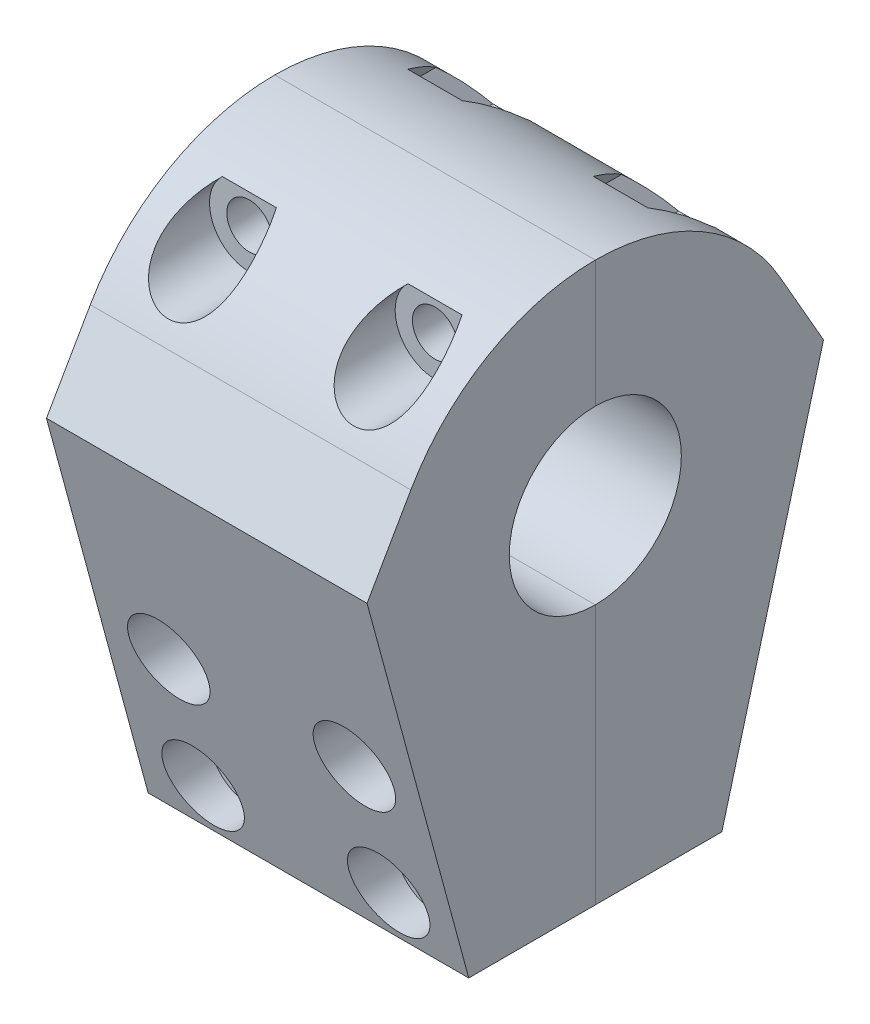
from build123d import *

# Parameters (mm, degrees)
SKETCH1_W              = 24.13
SKETCH1_H              = 19.05
SKETCH1_RX             = 3.81
SKETCH1_RY             = 3.175
BOSS_EXTRUDE1_DEPTH    = 8.255
SKETCH18_R             = 6.477
BOSS_EXTRUDE6_DEPTH    = 24.13
SKETCH4_R              = 1.7
CUT_EXTRUDE1_DEPTH     = 45.719846392
CUT_EXTRUDE4_START     = -2.54
SKETCH13_R             = 2.999999969
CUT_EXTRUDE4_DEPTH     = 48.259846392
CUT_EXTRUDE6_START     = -2.54
CUT_EXTRUDE6_DEPTH     = 48.259846392
SPLIT1_SURFACE_1_BACK  = 60.412
SPLIT1_SURFACE_1_DEPTH = 120.824
SPLIT1_SURFACE_2_BACK  = 60.412
SPLIT1_SURFACE_2_DEPTH = 120.824


with BuildPart() as part:
    # Sketch1 → Boss-Extrude1 (new, symmetric)
    with BuildSketch(Plane(origin=(0, 0, 0), x_dir=(1, 0, 0), z_dir=(0, 1, 0))):
        Rectangle(SKETCH1_W, SKETCH1_H)
        with Locations(Location((0, 0), (0, 0, 180))):
            Ellipse(SKETCH1_RX, SKETCH1_RY, mode=Mode.SUBTRACT)
    extrude(amount=BOSS_EXTRUDE1_DEPTH, both=True)

    # Sketch18 → Boss-Extrude6 (add)
    with BuildSketch(Plane.ZY.offset(12.065)):
        with BuildLine():
            Line((15.445133453, 13.595282971), (9.525, -8.255))
            Line((9.525, -8.255), (9.525, 8.255))
            Line((9.525, 8.255), (-9.525, 8.255))
            Line((-9.525, 8.255), (-9.525, -8.255))
            Line((-9.525, -8.255), (-15.445133453, 13.595282971))
            Line((-15.445133453, 13.595282971), (-17.178500001, 19.99286672))
            Line((-17.178500001, 19.99286672), (-13.88040039, 25.742316812))
            ThreePointArc((-13.88040039, 25.742316812), (0, 33.782), (13.88040039, 25.742316812))
            Line((13.88040039, 25.742316812), (17.178500001, 19.99286672))
            Line((17.178500001, 19.99286672), (15.445133453, 13.595282971))
        make_face()
        with Locations((0, 17.78)):
            Circle(SKETCH18_R, mode=Mode.SUBTRACT)
    extrude(amount=-BOSS_EXTRUDE6_DEPTH)

    # Sketch4 → Cut-Extrude1 (cut, through all)
    with BuildSketch(Plane.XY.offset(9.525)):
        with Locations((-6.985, 4.7625)):
            Circle(SKETCH4_R)
    cut_extrude1 = extrude(amount=-CUT_EXTRUDE1_DEPTH, mode=Mode.SUBTRACT)

    # Sketch13 → Cut-Extrude4 (cut)
    with BuildSketch(Plane.XY.offset(9.525).offset(CUT_EXTRUDE4_START)):
        with Locations(Location((-6.985, 4.7625, 0), (0, 0, 270))):
            Circle(SKETCH13_R)
    cut_extrude4 = extrude(amount=CUT_EXTRUDE4_DEPTH, mode=Mode.SUBTRACT)

    # Sketch19 → Cut-Extrude6 (cut)
    with BuildSketch(Plane(origin=(0, 0, -9.525), x_dir=(-1, 0, 0), z_dir=(0, 0, -1)).offset(CUT_EXTRUDE6_START)):
        Polygon((10.304764007, 4.7625), (8.644882004, 7.637499965), (5.325117996, 7.637499965), (3.665235993, 4.7625), (5.325117996, 1.887500035), (8.644882004, 1.887500035), align=None)
    cut_extrude6 = extrude(amount=CUT_EXTRUDE6_DEPTH, mode=Mode.SUBTRACT)

    # Sketch-Pattern1: Cut-Extrude1, Cut-Extrude4, Cut-Extrude6 at 5 more places
    with Locations((0, -9.525, 0), (13.97, 0, 0), (13.97, -9.525, 0), (13.97, 25.2095, 0), (0, 25.2095, 0)):
        add(cut_extrude1, mode=Mode.SUBTRACT)
        add(cut_extrude4, mode=Mode.SUBTRACT)
        add(cut_extrude6, mode=Mode.SUBTRACT)


with BuildPart() as body_2:
    # Split1: the piece behind the surface
    add(part.part)
    # Split1 surface: a surface, the sketch's curves swept straight by 120.824 mm
    with BuildLine(Plane(origin=(12.065, 0, 0), x_dir=(0, 0, -1), z_dir=(1, 0, 0)).offset(-SPLIT1_SURFACE_1_BACK), mode=Mode.PRIVATE) as split1_surface_1_path:
        Line((0, -8.255), (0, 33.782))
    split1_surface_1 = Shell.extrude(split1_surface_1_path.wire(), (1 * SPLIT1_SURFACE_1_DEPTH, 0 * SPLIT1_SURFACE_1_DEPTH, 0 * SPLIT1_SURFACE_1_DEPTH))
    split(bisect_by=split1_surface_1, keep=Keep.BOTTOM)


with BuildPart() as part_1:
    add(part.part)

    # Split1: split by a surface, the side it looks to stays
    # Split1 surface: a surface, the sketch's curves swept straight by 120.824 mm
    with BuildLine(Plane(origin=(12.065, 0, 0), x_dir=(0, 0, -1), z_dir=(1, 0, 0)).offset(-SPLIT1_SURFACE_2_BACK), mode=Mode.PRIVATE) as split1_surface_2_path:
        Line((0, -8.255), (0, 33.782))
    split1_surface_2 = Shell.extrude(split1_surface_2_path.wire(), (1 * SPLIT1_SURFACE_2_DEPTH, 0 * SPLIT1_SURFACE_2_DEPTH, 0 * SPLIT1_SURFACE_2_DEPTH))
    split(bisect_by=split1_surface_2, keep=Keep.TOP)


solid = Compound([body_2.part, part_1.part])
